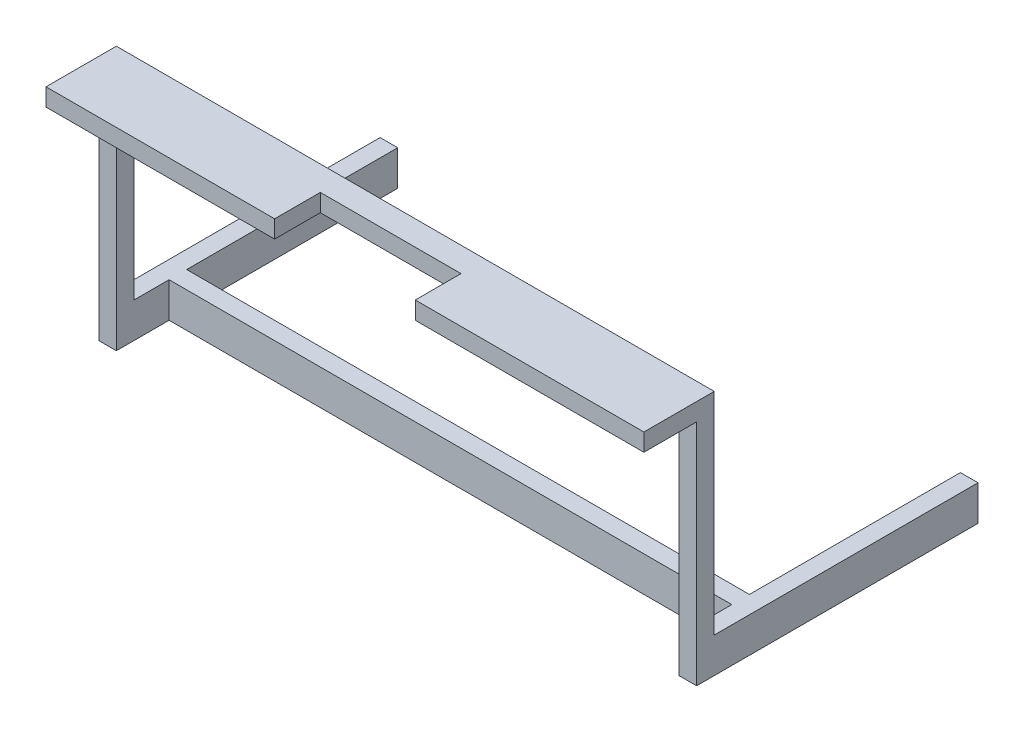
from build123d import *

# Parameters (mm, degrees)
EXTRUDE_2_DEPTH     = 170
SKETCH_5_W          = 160
SKETCH_5_H          = 60
CUT_EXTRUDE_2_DEPTH = 10
SKETCH_6_W          = 160
SKETCH_6_H          = 10
CUT_EXTRUDE_3_DEPTH = 10
SKETCH_7_W          = 160
SKETCH_7_H          = 55
CUT_EXTRUDE_4_DEPTH = 5
SKETCH_8_W          = 160
SKETCH_8_H          = 10
CUT_EXTRUDE_5_DEPTH = 5
CUT_EXTRUDE_6_DEPTH = 5


with BuildPart() as part:
    # 草图1 → 凸台-拉伸2 (new body)
    with BuildSketch(Plane(origin=(0, 0, 0), x_dir=(0, 0, -1), z_dir=(1, 0, 0))):
        Polygon((0, 0), (15, 0), (20, 0), (80, 0), (80, 10), (20, 10), (15, 10), (5, 10), (5, 70), (-15, 70), (-15, 65), (0, 65), align=None)
    extrude(amount=EXTRUDE_2_DEPTH)

    # 草图5 → 切除-拉伸2 (cut)
    with BuildSketch(Plane(origin=(0, 10, 0), x_dir=(1, 0, 0), z_dir=(0, 1, 0))):
        with Locations((85, 50)):
            Rectangle(SKETCH_5_W, SKETCH_5_H)
    extrude(amount=-CUT_EXTRUDE_2_DEPTH, mode=Mode.SUBTRACT)

    # 草图6 → 切除-拉伸3 (cut)
    with BuildSketch(Plane(origin=(0, 10, 0), x_dir=(1, 0, 0), z_dir=(0, 1, 0))):
        with Locations((85, 10)):
            Rectangle(SKETCH_6_W, SKETCH_6_H)
    extrude(amount=-CUT_EXTRUDE_3_DEPTH, mode=Mode.SUBTRACT)

    # 草图7 → 切除-拉伸4 (cut)
    with BuildSketch(Plane(origin=(0, 0, -5), x_dir=(-1, 0, 0), z_dir=(0, 0, -1))):
        with Locations((-85, 37.5)):
            Rectangle(SKETCH_7_W, SKETCH_7_H)
    extrude(amount=-CUT_EXTRUDE_4_DEPTH, mode=Mode.SUBTRACT)

    # 草图8 → 切除-拉伸5 (cut)
    with BuildSketch(Plane(origin=(0, 0, -5), x_dir=(-1, 0, 0), z_dir=(0, 0, -1))):
        with Locations((-85, 5)):
            Rectangle(SKETCH_8_W, SKETCH_8_H)
    extrude(amount=-CUT_EXTRUDE_5_DEPTH, mode=Mode.SUBTRACT)

    # 草图9 → 切除-拉伸6 (cut)
    with BuildSketch(Plane(origin=(0, 70, 0), x_dir=(1, 0, 0), z_dir=(0, 1, 0))):
        Polygon((85, -15), (105, -15), (105, -2), (65, -2), (65, -15), align=None)
    extrude(amount=-CUT_EXTRUDE_6_DEPTH, mode=Mode.SUBTRACT)


solid = part.part
